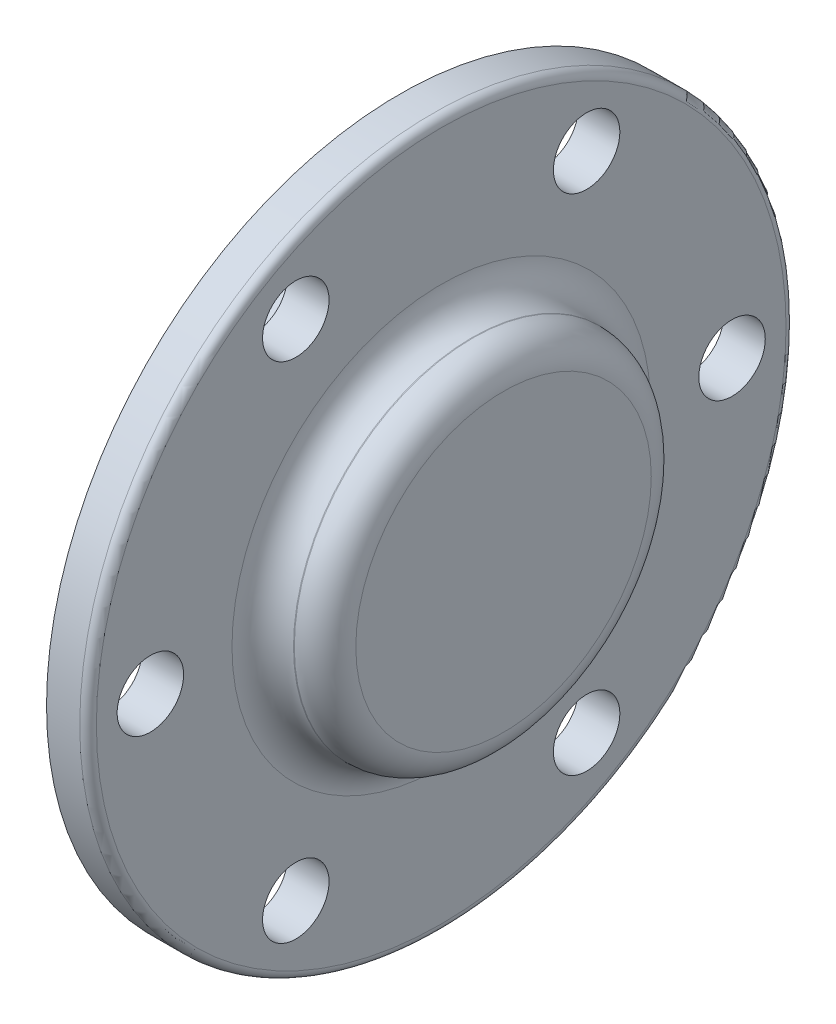
from build123d import *

# Parameters (mm, degrees)
CUT_EXTRUDE1_DEPTH      = 125.655525349
CUT_EXTRUDE1_DEPTH_BACK = 125.655525349
SKETCH2_R               = 8


with BuildPart() as part:
    # Sketch1 → Revolve1 (revolve)
    with BuildSketch(Plane.XY, mode=Mode.PRIVATE) as revolve1_sk:
        with BuildLine():
            Line((38, 23.139710977), (38, 0))
            Line((38, 0), (48, 0))
            Line((48, 0), (48, 35.560066311))
            ThreePointArc((48, 35.560066311), (45.832590181, 40.792656492), (40.6, 42.960066311))
            Line((40.6, 42.960066311), (40.4, 42.960066311))
            ThreePointArc((40.4, 42.960066311), (35.167409819, 45.127476131), (33, 50.360066311))
            Line((33, 50.360066311), (33, 83))
            ThreePointArc((33, 83), (32.414213562, 84.414213562), (31, 85))
            Line((31, 85), (23, 85))
            Line((23, 85), (23, 45))
            Line((23, 45), (0, 45))
            Line((0, 45), (0, 39))
            Line((0, 39), (32.515260934, 30.287562091))
            ThreePointArc((32.515260934, 30.287562091), (36.470814718, 27.644545551), (38, 23.139710977))
        make_face()
    revolve(revolve1_sk.sketch.rotate(Axis((0, 0, 0), (1, 0, 0)), 90), axis=Axis((0, 0, 0), (1, 0, 0)))

    # Sketch2 → Cut-Extrude1 (cut, two sides: drawn at the far end of the back side and taken through both)
    with BuildSketch(Plane(origin=(33, 0, 0), x_dir=(0, 0, -1), z_dir=(1, 0, 0)).offset(-CUT_EXTRUDE1_DEPTH_BACK)):
        with Locations((70, 0)):
            Circle(SKETCH2_R)
        with Locations((35, -60.621778265)):
            Circle(SKETCH2_R)
        with Locations((-35, -60.621778265)):
            Circle(SKETCH2_R)
        with Locations((-70, 0)):
            Circle(SKETCH2_R)
        with Locations((-35, 60.621778265)):
            Circle(SKETCH2_R)
        with Locations((35, 60.621778265)):
            Circle(SKETCH2_R)
    extrude(amount=CUT_EXTRUDE1_DEPTH + CUT_EXTRUDE1_DEPTH_BACK, mode=Mode.SUBTRACT)


solid = part.part
